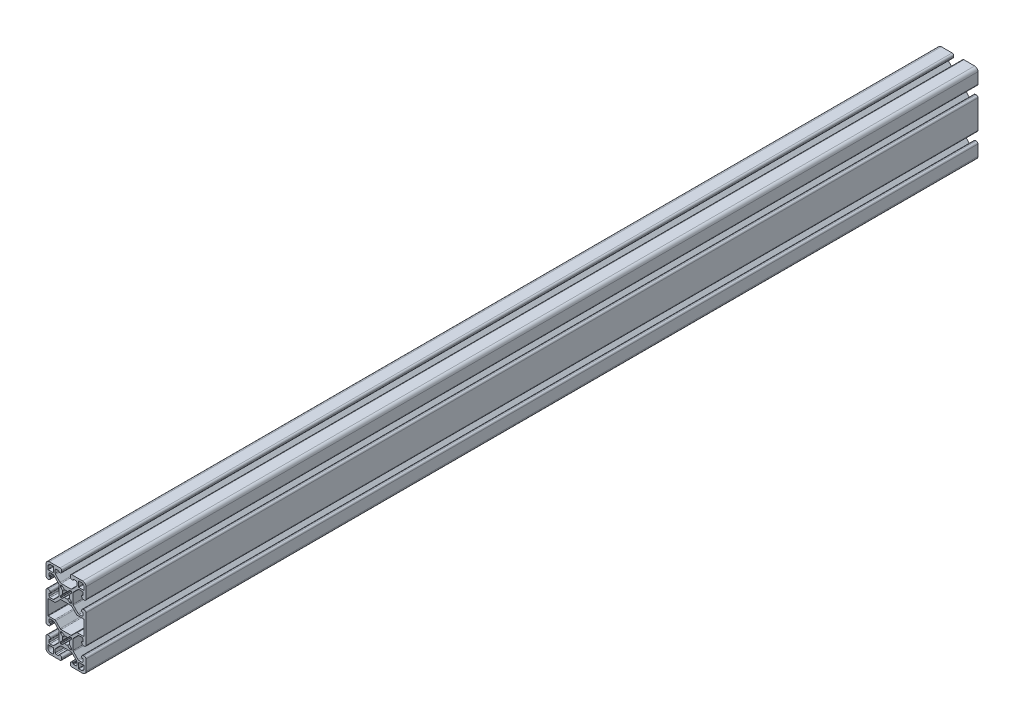
from build123d import *

# Parameters (mm, degrees)
BOSS_EXTRUDE1_DEPTH = 850


with BuildPart() as part:
    # Sketch1 → Boss-Extrude1 (new body)
    with BuildSketch(Plane(origin=(0, 0, -304.8), x_dir=(-1, 0, 0), z_dir=(0, 0, -1))):
        with BuildLine():
            Line((17.4752, 34.036), (16.5608, 34.036))
            ThreePointArc((16.5608, 34.036), (15.447248241, 33.574751759), (14.986, 32.4612))
            Line((14.986, 32.4612), (14.986, 31.623))
            ThreePointArc((14.986, 31.623), (15.097592316, 31.353592316), (15.367, 31.242))
            Line((15.367, 31.242), (15.6972, 31.242))
            ThreePointArc((15.6972, 31.242), (15.966607684, 31.130407684), (16.0782, 30.861))
            Line((16.0782, 30.861), (16.0782, 28.702))
            ThreePointArc((16.0782, 28.702), (15.817817928, 28.073382072), (15.1892, 27.813))
            Line((15.1892, 27.813), (12.375615789, 27.813))
            ThreePointArc((12.375615789, 27.813), (11.88960783, 27.909672994), (11.477590177, 28.184974388))
            Line((11.477590177, 28.184974388), (7.115674388, 32.546890177))
            ThreePointArc((7.115674388, 32.546890177), (6.840372994, 32.95890783), (6.7437, 33.444915789))
            Line((6.7437, 33.444915789), (6.7437, 42.755084211))
            ThreePointArc((6.7437, 42.755084211), (6.840372994, 43.24109217), (7.115674388, 43.653109823))
            Line((7.115674388, 43.653109823), (11.477590177, 48.015025612))
            ThreePointArc((11.477590177, 48.015025612), (11.88960783, 48.290327006), (12.375615789, 48.387))
            Line((12.375615789, 48.387), (15.1892, 48.387))
            ThreePointArc((15.1892, 48.387), (15.817817928, 48.126617928), (16.0782, 47.498))
            Line((16.0782, 47.498), (16.0782, 45.339))
            ThreePointArc((16.0782, 45.339), (15.966607684, 45.069592316), (15.6972, 44.958))
            Line((15.6972, 44.958), (15.367, 44.958))
            ThreePointArc((15.367, 44.958), (15.097592316, 44.846407684), (14.986, 44.577))
            Line((14.986, 44.577), (14.986, 43.7388))
            ThreePointArc((14.986, 43.7388), (15.447248241, 42.625248241), (16.5608, 42.164))
            Line((16.5608, 42.164), (17.4752, 42.164))
            ThreePointArc((17.4752, 42.164), (18.588751759, 42.625248241), (19.05, 43.7388))
            Line((19.05, 43.7388), (19.05, 53.975))
            ThreePointArc((19.05, 53.975), (18.12006403, 56.22006403), (15.875, 57.15))
            Line((15.875, 57.15), (5.6388, 57.15))
            ThreePointArc((5.6388, 57.15), (4.525248241, 56.688751759), (4.064, 55.5752))
            Line((4.064, 55.5752), (4.064, 54.6608))
            ThreePointArc((4.064, 54.6608), (4.525248241, 53.547248241), (5.6388, 53.086))
            Line((5.6388, 53.086), (6.477, 53.086))
            ThreePointArc((6.477, 53.086), (6.746407684, 53.197592316), (6.858, 53.467))
            Line((6.858, 53.467), (6.858, 53.7972))
            ThreePointArc((6.858, 53.7972), (6.969592316, 54.066607684), (7.239, 54.1782))
            Line((7.239, 54.1782), (9.398, 54.1782))
            ThreePointArc((9.398, 54.1782), (10.026617928, 53.917817928), (10.287, 53.2892))
            Line((10.287, 53.2892), (10.287, 50.475615789))
            ThreePointArc((10.287, 50.475615789), (10.190327006, 49.98960783), (9.915025612, 49.577590177))
            Line((9.915025612, 49.577590177), (5.553109823, 45.215674388))
            ThreePointArc((5.553109823, 45.215674388), (5.14109217, 44.940372994), (4.655084211, 44.8437))
            Line((4.655084211, 44.8437), (-4.655084211, 44.8437))
            ThreePointArc((-4.655084211, 44.8437), (-5.14109217, 44.940372994), (-5.553109823, 45.215674388))
            Line((-5.553109823, 45.215674388), (-9.915025612, 49.577590177))
            ThreePointArc((-9.915025612, 49.577590177), (-10.190327006, 49.98960783), (-10.287, 50.475615789))
            Line((-10.287, 50.475615789), (-10.287, 53.2892))
            ThreePointArc((-10.287, 53.2892), (-10.026617928, 53.917817928), (-9.398, 54.1782))
            Line((-9.398, 54.1782), (-7.239, 54.1782))
            ThreePointArc((-7.239, 54.1782), (-6.969592316, 54.066607684), (-6.858, 53.7972))
            Line((-6.858, 53.7972), (-6.858, 53.467))
            ThreePointArc((-6.858, 53.467), (-6.746407684, 53.197592316), (-6.477, 53.086))
            Line((-6.477, 53.086), (-5.6388, 53.086))
            ThreePointArc((-5.6388, 53.086), (-4.525248241, 53.547248241), (-4.064, 54.6608))
            Line((-4.064, 54.6608), (-4.064, 55.5752))
            ThreePointArc((-4.064, 55.5752), (-4.525248241, 56.688751759), (-5.6388, 57.15))
            Line((-5.6388, 57.15), (-15.875, 57.15))
            ThreePointArc((-15.875, 57.15), (-18.12006403, 56.22006403), (-19.05, 53.975))
            Line((-19.05, 53.975), (-19.05, 43.7388))
            ThreePointArc((-19.05, 43.7388), (-18.588751759, 42.625248241), (-17.4752, 42.164))
            Line((-17.4752, 42.164), (-16.5608, 42.164))
            ThreePointArc((-16.5608, 42.164), (-15.447248241, 42.625248241), (-14.986, 43.7388))
            Line((-14.986, 43.7388), (-14.986, 44.577))
            ThreePointArc((-14.986, 44.577), (-15.097592316, 44.846407684), (-15.367, 44.958))
            Line((-15.367, 44.958), (-15.6972, 44.958))
            ThreePointArc((-15.6972, 44.958), (-15.966607684, 45.069592316), (-16.0782, 45.339))
            Line((-16.0782, 45.339), (-16.0782, 47.498))
            ThreePointArc((-16.0782, 47.498), (-15.817817928, 48.126617928), (-15.1892, 48.387))
            Line((-15.1892, 48.387), (-12.375615789, 48.387))
            ThreePointArc((-12.375615789, 48.387), (-11.88960783, 48.290327006), (-11.477590177, 48.015025612))
            Line((-11.477590177, 48.015025612), (-7.115674388, 43.653109823))
            ThreePointArc((-7.115674388, 43.653109823), (-6.840372994, 43.24109217), (-6.7437, 42.755084211))
            Line((-6.7437, 42.755084211), (-6.7437, 33.444915789))
            ThreePointArc((-6.7437, 33.444915789), (-6.840372994, 32.95890783), (-7.115674388, 32.546890177))
            Line((-7.115674388, 32.546890177), (-11.477590177, 28.184974388))
            ThreePointArc((-11.477590177, 28.184974388), (-11.88960783, 27.909672994), (-12.375615789, 27.813))
            Line((-12.375615789, 27.813), (-15.1892, 27.813))
            ThreePointArc((-15.1892, 27.813), (-15.817817928, 28.073382072), (-16.0782, 28.702))
            Line((-16.0782, 28.702), (-16.0782, 30.861))
            ThreePointArc((-16.0782, 30.861), (-15.966607684, 31.130407684), (-15.6972, 31.242))
            Line((-15.6972, 31.242), (-15.367, 31.242))
            ThreePointArc((-15.367, 31.242), (-15.097592316, 31.353592316), (-14.986, 31.623))
            Line((-14.986, 31.623), (-14.986, 32.4612))
            ThreePointArc((-14.986, 32.4612), (-15.447248241, 33.574751759), (-16.5608, 34.036))
            Line((-16.5608, 34.036), (-17.4752, 34.036))
            ThreePointArc((-17.4752, 34.036), (-18.588751759, 33.574751759), (-19.05, 32.4612))
            Line((-19.05, 32.4612), (-19.05, 5.6388))
            ThreePointArc((-19.05, 5.6388), (-18.588751759, 4.525248241), (-17.4752, 4.064))
            Line((-17.4752, 4.064), (-16.5608, 4.064))
            ThreePointArc((-16.5608, 4.064), (-15.447248241, 4.525248241), (-14.986, 5.6388))
            Line((-14.986, 5.6388), (-14.986, 6.477))
            ThreePointArc((-14.986, 6.477), (-15.097592316, 6.746407684), (-15.367, 6.858))
            Line((-15.367, 6.858), (-15.6972, 6.858))
            ThreePointArc((-15.6972, 6.858), (-15.966607684, 6.969592316), (-16.0782, 7.239))
            Line((-16.0782, 7.239), (-16.0782, 9.398))
            ThreePointArc((-16.0782, 9.398), (-15.817817928, 10.026617928), (-15.1892, 10.287))
            Line((-15.1892, 10.287), (-12.375615789, 10.287))
            ThreePointArc((-12.375615789, 10.287), (-11.88960783, 10.190327006), (-11.477590177, 9.915025612))
            Line((-11.477590177, 9.915025612), (-7.115674388, 5.553109823))
            ThreePointArc((-7.115674388, 5.553109823), (-6.840372994, 5.14109217), (-6.7437, 4.655084211))
            Line((-6.7437, 4.655084211), (-6.7437, -4.655084211))
            ThreePointArc((-6.7437, -4.655084211), (-6.840372994, -5.14109217), (-7.115674388, -5.553109823))
            Line((-7.115674388, -5.553109823), (-11.477590177, -9.915025612))
            ThreePointArc((-11.477590177, -9.915025612), (-11.88960783, -10.190327006), (-12.375615789, -10.287))
            Line((-12.375615789, -10.287), (-15.1892, -10.287))
            ThreePointArc((-15.1892, -10.287), (-15.817817928, -10.026617928), (-16.0782, -9.398))
            Line((-16.0782, -9.398), (-16.0782, -7.239))
            ThreePointArc((-16.0782, -7.239), (-15.966607684, -6.969592316), (-15.6972, -6.858))
            Line((-15.6972, -6.858), (-15.367, -6.858))
            ThreePointArc((-15.367, -6.858), (-15.097592316, -6.746407684), (-14.986, -6.477))
            Line((-14.986, -6.477), (-14.986, -5.6388))
            ThreePointArc((-14.986, -5.6388), (-15.447248241, -4.525248241), (-16.5608, -4.064))
            Line((-16.5608, -4.064), (-17.4752, -4.064))
            ThreePointArc((-17.4752, -4.064), (-18.588751759, -4.525248241), (-19.05, -5.6388))
            Line((-19.05, -5.6388), (-19.05, -15.875))
            ThreePointArc((-19.05, -15.875), (-18.12006403, -18.12006403), (-15.875, -19.05))
            Line((-15.875, -19.05), (-5.6388, -19.05))
            ThreePointArc((-5.6388, -19.05), (-4.525248241, -18.588751759), (-4.064, -17.4752))
            Line((-4.064, -17.4752), (-4.064, -16.5608))
            ThreePointArc((-4.064, -16.5608), (-4.525248241, -15.447248241), (-5.6388, -14.986))
            Line((-5.6388, -14.986), (-6.477, -14.986))
            ThreePointArc((-6.477, -14.986), (-6.746407684, -15.097592316), (-6.858, -15.367))
            Line((-6.858, -15.367), (-6.858, -15.6972))
            ThreePointArc((-6.858, -15.6972), (-6.969592316, -15.966607684), (-7.239, -16.0782))
            Line((-7.239, -16.0782), (-9.398, -16.0782))
            ThreePointArc((-9.398, -16.0782), (-10.026617928, -15.817817928), (-10.287, -15.1892))
            Line((-10.287, -15.1892), (-10.287, -12.375615789))
            ThreePointArc((-10.287, -12.375615789), (-10.190327006, -11.88960783), (-9.915025612, -11.477590177))
            Line((-9.915025612, -11.477590177), (-5.553109823, -7.115674388))
            ThreePointArc((-5.553109823, -7.115674388), (-5.14109217, -6.840372994), (-4.655084211, -6.7437))
            Line((-4.655084211, -6.7437), (4.655084211, -6.7437))
            ThreePointArc((4.655084211, -6.7437), (5.14109217, -6.840372994), (5.553109823, -7.115674388))
            Line((5.553109823, -7.115674388), (9.915025612, -11.477590177))
            ThreePointArc((9.915025612, -11.477590177), (10.190327006, -11.88960783), (10.287, -12.375615789))
            Line((10.287, -12.375615789), (10.287, -15.1892))
            ThreePointArc((10.287, -15.1892), (10.026617928, -15.817817928), (9.398, -16.0782))
            Line((9.398, -16.0782), (7.239, -16.0782))
            ThreePointArc((7.239, -16.0782), (6.969592316, -15.966607684), (6.858, -15.6972))
            Line((6.858, -15.6972), (6.858, -15.367))
            ThreePointArc((6.858, -15.367), (6.746407684, -15.097592316), (6.477, -14.986))
            Line((6.477, -14.986), (5.6388, -14.986))
            ThreePointArc((5.6388, -14.986), (4.525248241, -15.447248241), (4.064, -16.5608))
            Line((4.064, -16.5608), (4.064, -17.4752))
            ThreePointArc((4.064, -17.4752), (4.525248241, -18.588751759), (5.6388, -19.05))
            Line((5.6388, -19.05), (15.875, -19.05))
            ThreePointArc((15.875, -19.05), (18.12006403, -18.12006403), (19.05, -15.875))
            Line((19.05, -15.875), (19.05, -5.6388))
            ThreePointArc((19.05, -5.6388), (18.588751759, -4.525248241), (17.4752, -4.064))
            Line((17.4752, -4.064), (16.5608, -4.064))
            ThreePointArc((16.5608, -4.064), (15.447248241, -4.525248241), (14.986, -5.6388))
            Line((14.986, -5.6388), (14.986, -6.477))
            ThreePointArc((14.986, -6.477), (15.097592316, -6.746407684), (15.367, -6.858))
            Line((15.367, -6.858), (15.6972, -6.858))
            ThreePointArc((15.6972, -6.858), (15.966607684, -6.969592316), (16.0782, -7.239))
            Line((16.0782, -7.239), (16.0782, -9.398))
            ThreePointArc((16.0782, -9.398), (15.817817928, -10.026617928), (15.1892, -10.287))
            Line((15.1892, -10.287), (12.375615789, -10.287))
            ThreePointArc((12.375615789, -10.287), (11.88960783, -10.190327006), (11.477590177, -9.915025612))
            Line((11.477590177, -9.915025612), (7.115674388, -5.553109823))
            ThreePointArc((7.115674388, -5.553109823), (6.840372994, -5.14109217), (6.7437, -4.655084211))
            Line((6.7437, -4.655084211), (6.7437, 4.655084211))
            ThreePointArc((6.7437, 4.655084211), (6.840372994, 5.14109217), (7.115674388, 5.553109823))
            Line((7.115674388, 5.553109823), (11.477590177, 9.915025612))
            ThreePointArc((11.477590177, 9.915025612), (11.88960783, 10.190327006), (12.375615789, 10.287))
            Line((12.375615789, 10.287), (15.1892, 10.287))
            ThreePointArc((15.1892, 10.287), (15.817817928, 10.026617928), (16.0782, 9.398))
            Line((16.0782, 9.398), (16.0782, 7.239))
            ThreePointArc((16.0782, 7.239), (15.966607684, 6.969592316), (15.6972, 6.858))
            Line((15.6972, 6.858), (15.367, 6.858))
            ThreePointArc((15.367, 6.858), (15.097592316, 6.746407684), (14.986, 6.477))
            Line((14.986, 6.477), (14.986, 5.6388))
            ThreePointArc((14.986, 5.6388), (15.447248241, 4.525248241), (16.5608, 4.064))
            Line((16.5608, 4.064), (17.4752, 4.064))
            ThreePointArc((17.4752, 4.064), (18.588751759, 4.525248241), (19.05, 5.6388))
            Line((19.05, 5.6388), (19.05, 32.4612))
            ThreePointArc((19.05, 32.4612), (18.588751759, 33.574751759), (17.4752, 34.036))
        make_face()
        with BuildLine():
            Line((-16.8656, -11.8618), (-12.2428, -11.8618))
            ThreePointArc((-12.2428, -11.8618), (-11.973392316, -11.973392316), (-11.8618, -12.2428))
            Line((-11.8618, -12.2428), (-11.8618, -16.8656))
            ThreePointArc((-11.8618, -16.8656), (-11.973392316, -17.135007684), (-12.2428, -17.2466))
            Line((-12.2428, -17.2466), (-14.4526, -17.2466))
            ThreePointArc((-14.4526, -17.2466), (-16.428256347, -16.428256347), (-17.2466, -14.4526))
            Line((-17.2466, -14.4526), (-17.2466, -12.2428))
            ThreePointArc((-17.2466, -12.2428), (-17.135007684, -11.973392316), (-16.8656, -11.8618))
        make_face(mode=Mode.SUBTRACT)
        with BuildLine():
            Line((-1.582347442, -3.198793543), (-3.292097227, -4.908543328))
            ThreePointArc((-3.292097227, -4.908543328), (-3.580509584, -5.101254304), (-3.920715155, -5.1689254))
            Line((-3.920715155, -5.1689254), (-4.9149254, -5.1689254))
            ThreePointArc((-4.9149254, -5.1689254), (-5.094530522, -5.094530522), (-5.1689254, -4.9149254))
            Line((-5.1689254, -4.9149254), (-5.1689254, -3.920715155))
            ThreePointArc((-5.1689254, -3.920715155), (-5.101254304, -3.580509584), (-4.908543328, -3.292097227))
            Line((-4.908543328, -3.292097227), (-3.198793543, -1.582347442))
            ThreePointArc((-3.198793543, -1.582347442), (-3.095711236, -1.393016011), (-3.111879183, -1.178048687))
            ThreePointArc((-3.111879183, -1.178048687), (-3.3274, 0), (-3.111879183, 1.178048687))
            ThreePointArc((-3.111879183, 1.178048687), (-3.095711236, 1.393016011), (-3.198793543, 1.582347442))
            Line((-3.198793543, 1.582347442), (-4.908543328, 3.292097227))
            ThreePointArc((-4.908543328, 3.292097227), (-5.101254304, 3.580509584), (-5.1689254, 3.920715155))
            Line((-5.1689254, 3.920715155), (-5.1689254, 4.9149254))
            ThreePointArc((-5.1689254, 4.9149254), (-5.094530522, 5.094530522), (-4.9149254, 5.1689254))
            Line((-4.9149254, 5.1689254), (-3.920715155, 5.1689254))
            ThreePointArc((-3.920715155, 5.1689254), (-3.580509584, 5.101254304), (-3.292097227, 4.908543328))
            Line((-3.292097227, 4.908543328), (-1.582347442, 3.198793543))
            ThreePointArc((-1.582347442, 3.198793543), (-1.393016011, 3.095711236), (-1.178048687, 3.111879183))
            ThreePointArc((-1.178048687, 3.111879183), (0, 3.3274), (1.178048687, 3.111879183))
            ThreePointArc((1.178048687, 3.111879183), (1.393016011, 3.095711236), (1.582347442, 3.198793543))
            Line((1.582347442, 3.198793543), (3.292097227, 4.908543328))
            ThreePointArc((3.292097227, 4.908543328), (3.580509584, 5.101254304), (3.920715155, 5.1689254))
            Line((3.920715155, 5.1689254), (4.9149254, 5.1689254))
            ThreePointArc((4.9149254, 5.1689254), (5.094530522, 5.094530522), (5.1689254, 4.9149254))
            Line((5.1689254, 4.9149254), (5.1689254, 3.920715155))
            ThreePointArc((5.1689254, 3.920715155), (5.101254304, 3.580509584), (4.908543328, 3.292097227))
            Line((4.908543328, 3.292097227), (3.198793543, 1.582347442))
            ThreePointArc((3.198793543, 1.582347442), (3.095711236, 1.393016011), (3.111879183, 1.178048687))
            ThreePointArc((3.111879183, 1.178048687), (3.3274, 0), (3.111879183, -1.178048687))
            ThreePointArc((3.111879183, -1.178048687), (3.095711236, -1.393016011), (3.198793543, -1.582347442))
            Line((3.198793543, -1.582347442), (4.908543328, -3.292097227))
            ThreePointArc((4.908543328, -3.292097227), (5.101254304, -3.580509584), (5.1689254, -3.920715155))
            Line((5.1689254, -3.920715155), (5.1689254, -4.9149254))
            ThreePointArc((5.1689254, -4.9149254), (5.094530522, -5.094530522), (4.9149254, -5.1689254))
            Line((4.9149254, -5.1689254), (3.920715155, -5.1689254))
            ThreePointArc((3.920715155, -5.1689254), (3.580509584, -5.101254304), (3.292097227, -4.908543328))
            Line((3.292097227, -4.908543328), (1.582347442, -3.198793543))
            ThreePointArc((1.582347442, -3.198793543), (1.393016011, -3.095711236), (1.178048687, -3.111879183))
            ThreePointArc((1.178048687, -3.111879183), (0, -3.3274), (-1.178048687, -3.111879183))
            ThreePointArc((-1.178048687, -3.111879183), (-1.393016011, -3.095711236), (-1.582347442, -3.198793543))
        make_face(mode=Mode.SUBTRACT)
        with BuildLine():
            Line((16.8656, 49.9618), (12.2428, 49.9618))
            ThreePointArc((12.2428, 49.9618), (11.973392316, 50.073392316), (11.8618, 50.3428))
            Line((11.8618, 50.3428), (11.8618, 54.9656))
            ThreePointArc((11.8618, 54.9656), (11.973392316, 55.235007684), (12.2428, 55.3466))
            Line((12.2428, 55.3466), (14.4526, 55.3466))
            ThreePointArc((14.4526, 55.3466), (16.428256347, 54.528256347), (17.2466, 52.5526))
            Line((17.2466, 52.5526), (17.2466, 50.3428))
            ThreePointArc((17.2466, 50.3428), (17.135007684, 50.073392316), (16.8656, 49.9618))
        make_face(mode=Mode.SUBTRACT)
        with BuildLine():
            Line((-12.2428, 49.9618), (-16.8656, 49.9618))
            ThreePointArc((-16.8656, 49.9618), (-17.135007684, 50.073392316), (-17.2466, 50.3428))
            Line((-17.2466, 50.3428), (-17.2466, 52.5526))
            ThreePointArc((-17.2466, 52.5526), (-16.428256347, 54.528256347), (-14.4526, 55.3466))
            Line((-14.4526, 55.3466), (-12.2428, 55.3466))
            ThreePointArc((-12.2428, 55.3466), (-11.973392316, 55.235007684), (-11.8618, 54.9656))
            Line((-11.8618, 54.9656), (-11.8618, 50.3428))
            ThreePointArc((-11.8618, 50.3428), (-11.973392316, 50.073392316), (-12.2428, 49.9618))
        make_face(mode=Mode.SUBTRACT)
        with BuildLine():
            Line((-1.582347442, 34.901206457), (-3.292097227, 33.191456672))
            ThreePointArc((-3.292097227, 33.191456672), (-3.580509584, 32.998745696), (-3.920715155, 32.9310746))
            Line((-3.920715155, 32.9310746), (-4.9149254, 32.9310746))
            ThreePointArc((-4.9149254, 32.9310746), (-5.094530522, 33.005469478), (-5.1689254, 33.1850746))
            Line((-5.1689254, 33.1850746), (-5.1689254, 34.179284845))
            ThreePointArc((-5.1689254, 34.179284845), (-5.101254304, 34.519490416), (-4.908543328, 34.807902773))
            Line((-4.908543328, 34.807902773), (-3.198793543, 36.517652558))
            ThreePointArc((-3.198793543, 36.517652558), (-3.095711236, 36.706983989), (-3.111879183, 36.921951313))
            ThreePointArc((-3.111879183, 36.921951313), (-3.3274, 38.1), (-3.111879183, 39.278048687))
            ThreePointArc((-3.111879183, 39.278048687), (-3.095711236, 39.493016011), (-3.198793543, 39.682347442))
            Line((-3.198793543, 39.682347442), (-4.908543328, 41.392097227))
            ThreePointArc((-4.908543328, 41.392097227), (-5.101254304, 41.680509584), (-5.1689254, 42.020715155))
            Line((-5.1689254, 42.020715155), (-5.1689254, 43.0149254))
            ThreePointArc((-5.1689254, 43.0149254), (-5.094530522, 43.194530522), (-4.9149254, 43.2689254))
            Line((-4.9149254, 43.2689254), (-3.920715155, 43.2689254))
            ThreePointArc((-3.920715155, 43.2689254), (-3.580509584, 43.201254304), (-3.292097227, 43.008543328))
            Line((-3.292097227, 43.008543328), (-1.582347442, 41.298793543))
            ThreePointArc((-1.582347442, 41.298793543), (-1.393016011, 41.195711236), (-1.178048687, 41.211879183))
            ThreePointArc((-1.178048687, 41.211879183), (0, 41.4274), (1.178048687, 41.211879183))
            ThreePointArc((1.178048687, 41.211879183), (1.393016011, 41.195711236), (1.582347442, 41.298793543))
            Line((1.582347442, 41.298793543), (3.292097227, 43.008543328))
            ThreePointArc((3.292097227, 43.008543328), (3.580509584, 43.201254304), (3.920715155, 43.2689254))
            Line((3.920715155, 43.2689254), (4.9149254, 43.2689254))
            ThreePointArc((4.9149254, 43.2689254), (5.094530522, 43.194530522), (5.1689254, 43.0149254))
            Line((5.1689254, 43.0149254), (5.1689254, 42.020715155))
            ThreePointArc((5.1689254, 42.020715155), (5.101254304, 41.680509584), (4.908543328, 41.392097227))
            Line((4.908543328, 41.392097227), (3.198793543, 39.682347442))
            ThreePointArc((3.198793543, 39.682347442), (3.095711236, 39.493016011), (3.111879183, 39.278048687))
            ThreePointArc((3.111879183, 39.278048687), (3.3274, 38.1), (3.111879183, 36.921951313))
            ThreePointArc((3.111879183, 36.921951313), (3.095711236, 36.706983989), (3.198793543, 36.517652558))
            Line((3.198793543, 36.517652558), (4.908543328, 34.807902773))
            ThreePointArc((4.908543328, 34.807902773), (5.101254304, 34.519490416), (5.1689254, 34.179284845))
            Line((5.1689254, 34.179284845), (5.1689254, 33.1850746))
            ThreePointArc((5.1689254, 33.1850746), (5.094530522, 33.005469478), (4.9149254, 32.9310746))
            Line((4.9149254, 32.9310746), (3.920715155, 32.9310746))
            ThreePointArc((3.920715155, 32.9310746), (3.580509584, 32.998745696), (3.292097227, 33.191456672))
            Line((3.292097227, 33.191456672), (1.582347442, 34.901206457))
            ThreePointArc((1.582347442, 34.901206457), (1.393016011, 35.004288764), (1.178048687, 34.988120817))
            ThreePointArc((1.178048687, 34.988120817), (0, 34.7726), (-1.178048687, 34.988120817))
            ThreePointArc((-1.178048687, 34.988120817), (-1.393016011, 35.004288764), (-1.582347442, 34.901206457))
        make_face(mode=Mode.SUBTRACT)
        with BuildLine():
            Line((17.2466, 25.8572), (17.2466, 12.2428))
            ThreePointArc((17.2466, 12.2428), (17.135007684, 11.973392316), (16.8656, 11.8618))
            Line((16.8656, 11.8618), (10.825286659, 11.8618))
            ThreePointArc((10.825286659, 11.8618), (10.3392787, 11.765127006), (9.927261047, 11.489825612))
            Line((9.927261047, 11.489825612), (5.553109823, 7.115674388))
            ThreePointArc((5.553109823, 7.115674388), (5.14109217, 6.840372994), (4.655084211, 6.7437))
            Line((4.655084211, 6.7437), (-4.655084211, 6.7437))
            ThreePointArc((-4.655084211, 6.7437), (-5.14109217, 6.840372994), (-5.553109823, 7.115674388))
            Line((-5.553109823, 7.115674388), (-9.927261047, 11.489825612))
            ThreePointArc((-9.927261047, 11.489825612), (-10.3392787, 11.765127006), (-10.825286659, 11.8618))
            Line((-10.825286659, 11.8618), (-16.8656, 11.8618))
            ThreePointArc((-16.8656, 11.8618), (-17.135007684, 11.973392316), (-17.2466, 12.2428))
            Line((-17.2466, 12.2428), (-17.2466, 25.8572))
            ThreePointArc((-17.2466, 25.8572), (-17.135007684, 26.126607684), (-16.8656, 26.2382))
            Line((-16.8656, 26.2382), (-10.825286659, 26.2382))
            ThreePointArc((-10.825286659, 26.2382), (-10.3392787, 26.334872994), (-9.927261047, 26.610174388))
            Line((-9.927261047, 26.610174388), (-5.553109823, 30.984325612))
            ThreePointArc((-5.553109823, 30.984325612), (-5.14109217, 31.259627006), (-4.655084211, 31.3563))
            Line((-4.655084211, 31.3563), (4.655084211, 31.3563))
            ThreePointArc((4.655084211, 31.3563), (5.14109217, 31.259627006), (5.553109823, 30.984325612))
            Line((5.553109823, 30.984325612), (9.927261047, 26.610174388))
            ThreePointArc((9.927261047, 26.610174388), (10.3392787, 26.334872994), (10.825286659, 26.2382))
            Line((10.825286659, 26.2382), (16.8656, 26.2382))
            ThreePointArc((16.8656, 26.2382), (17.135007684, 26.126607684), (17.2466, 25.8572))
        make_face(mode=Mode.SUBTRACT)
        with BuildLine():
            Line((12.2428, -11.8618), (16.8656, -11.8618))
            ThreePointArc((16.8656, -11.8618), (17.135007684, -11.973392316), (17.2466, -12.2428))
            Line((17.2466, -12.2428), (17.2466, -14.4526))
            ThreePointArc((17.2466, -14.4526), (16.428256347, -16.428256347), (14.4526, -17.2466))
            Line((14.4526, -17.2466), (12.2428, -17.2466))
            ThreePointArc((12.2428, -17.2466), (11.973392316, -17.135007684), (11.8618, -16.8656))
            Line((11.8618, -16.8656), (11.8618, -12.2428))
            ThreePointArc((11.8618, -12.2428), (11.973392316, -11.973392316), (12.2428, -11.8618))
        make_face(mode=Mode.SUBTRACT)
    extrude(amount=-BOSS_EXTRUDE1_DEPTH)


solid = part.part
